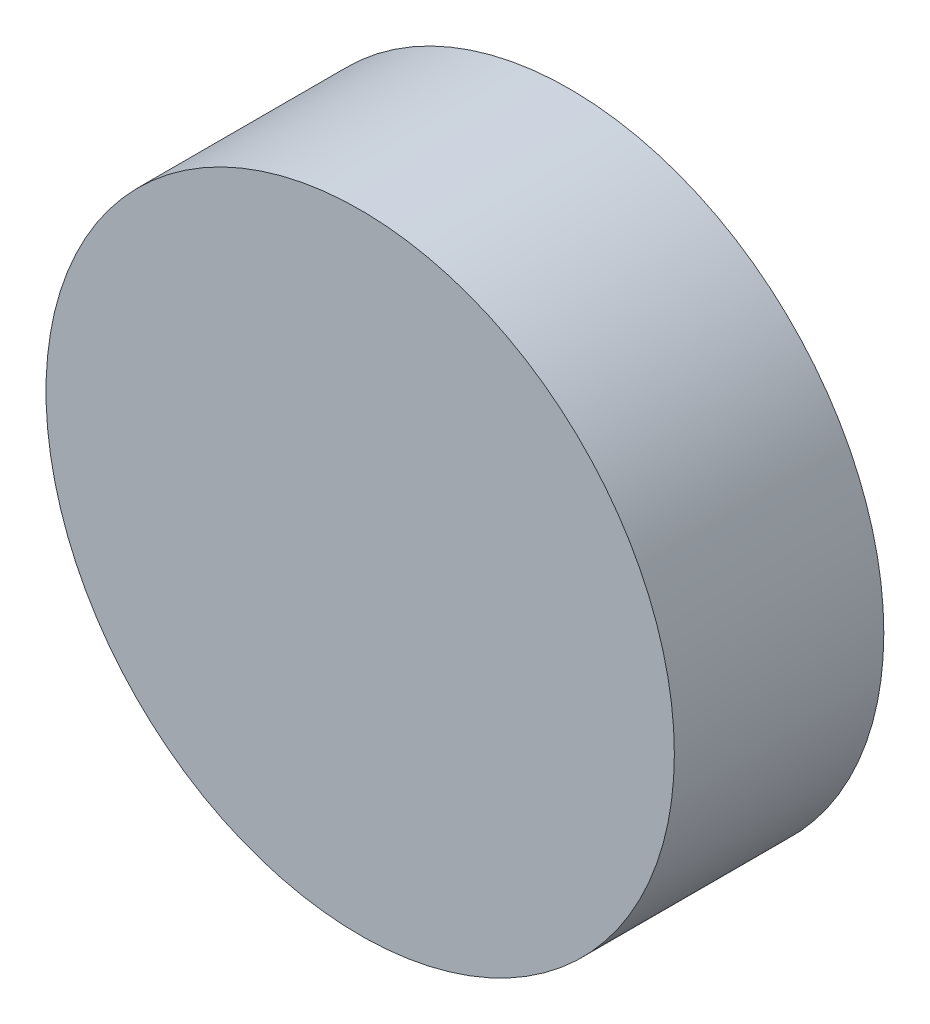
from build123d import *

# Parameters (mm, degrees)
SKETCH_1_R      = 75
EXTRUDE_1_DEPTH = 50


with BuildPart() as part:
    # 草图1 → 凸台-拉伸1 (new body)
    with BuildSketch(Plane.XY):
        Circle(SKETCH_1_R)
    extrude(amount=EXTRUDE_1_DEPTH)


solid = part.part
